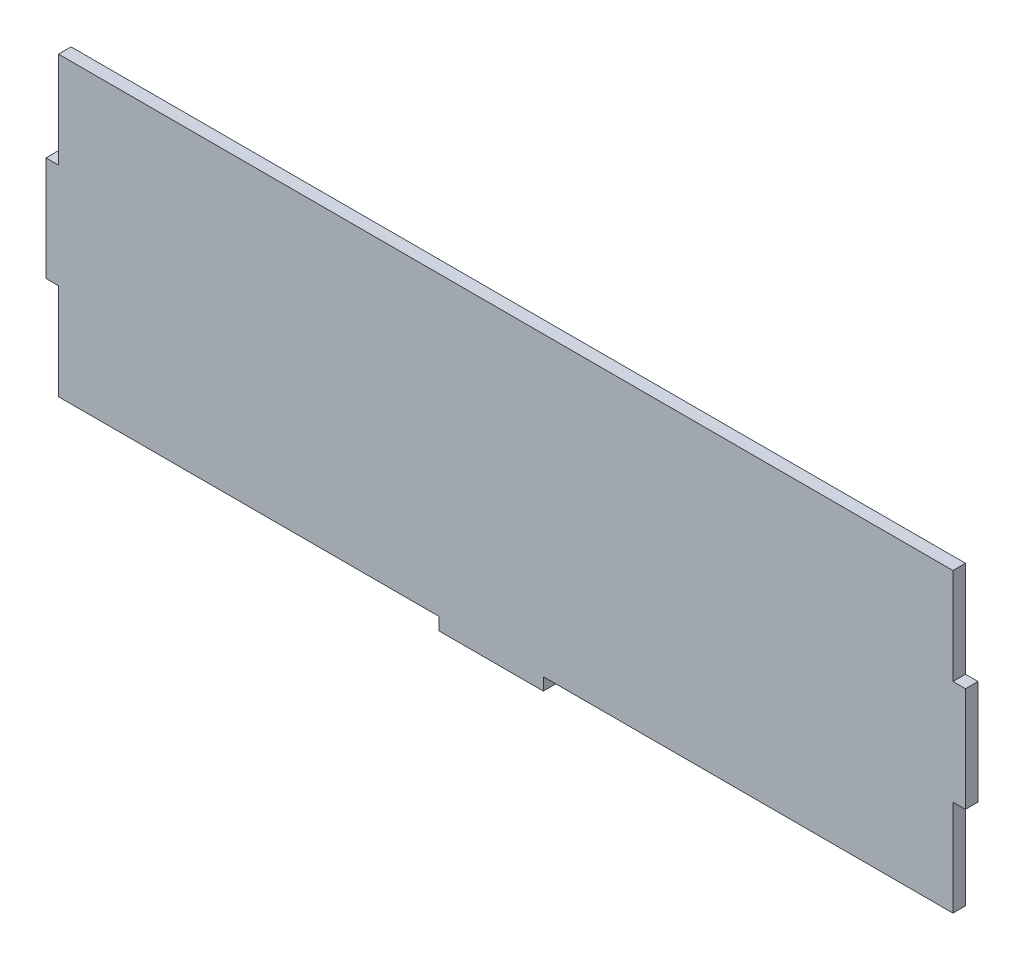
from build123d import *

# Parameters (mm, degrees)
BOSS_EXTRUDE1_DEPTH = 6


with BuildPart() as part:
    # Sketch1 → Boss-Extrude1 (new body)
    with BuildSketch(Plane.XY):
        Polygon((0, 0), (428, 0), (428, -46), (434, -46), (434, -96), (428, -96), (428, -142), (232, -142), (232, -148), (182, -148), (182, -142), (0, -142), (0, -96), (-6, -96), (-6, -46), (0, -46), align=None)
    extrude(amount=BOSS_EXTRUDE1_DEPTH)


solid = part.part
